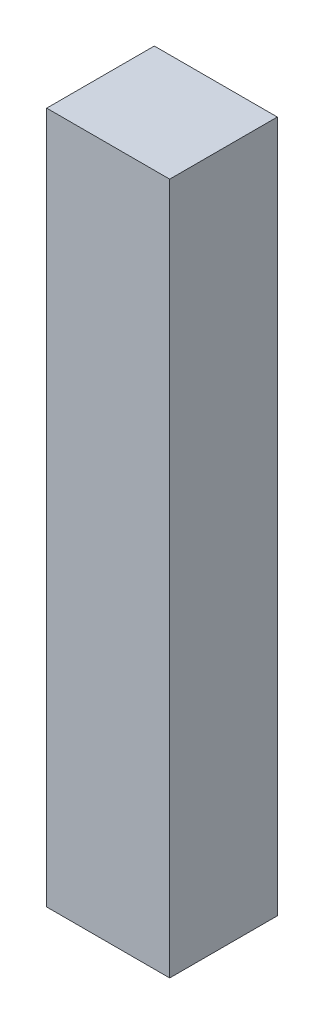
from build123d import *

# Parameters (mm, degrees)
SKETCH1_W           = 8
SKETCH1_H           = 7
BOSS_EXTRUDE1_DEPTH = 45


with BuildPart() as part:
    # Sketch1 → Boss-Extrude1 (new body)
    with BuildSketch(Plane(origin=(0, 0, 0), x_dir=(1, 0, 0), z_dir=(0, 1, 0))):
        with Locations((4, 3.5)):
            Rectangle(SKETCH1_W, SKETCH1_H)
    extrude(amount=BOSS_EXTRUDE1_DEPTH)


solid = part.part
